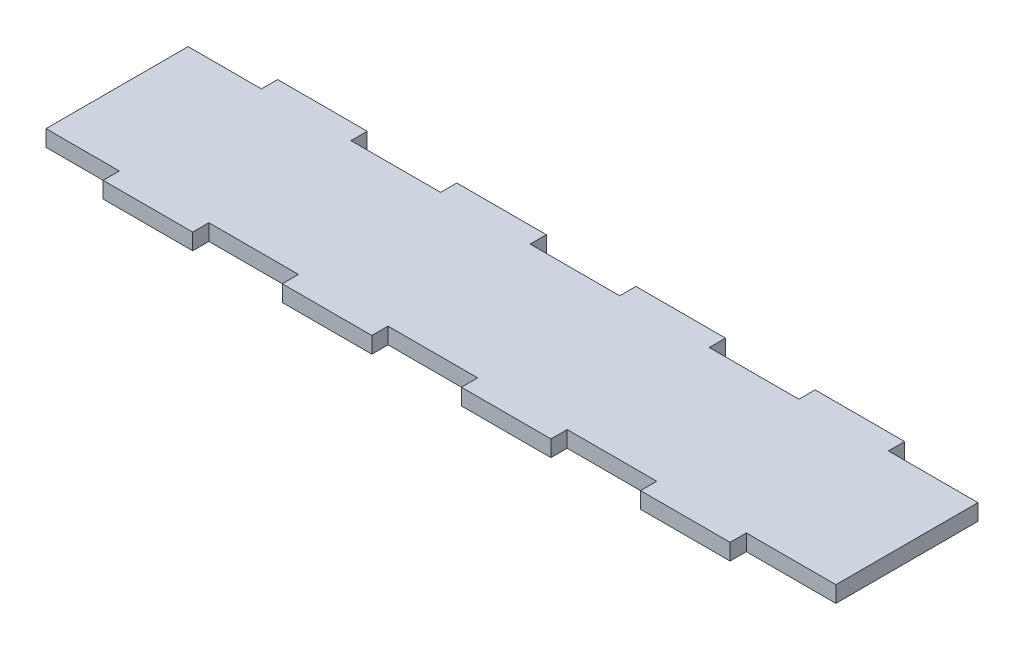
from build123d import *

# Parameters (mm, degrees)
SKETCH1_W           = 228.6
SKETCH1_H           = 49.499999806
BOSS_EXTRUDE1_DEPTH = 4.599999944
SKETCH3_W           = 25.4
SKETCH3_H           = 4.599999944
CUT_EXTRUDE1_DEPTH  = 234.943091328
SKETCH4_W           = 4.599999944
SKETCH4_H           = 40.299999918
CUT_EXTRUDE2_DEPTH  = 234.943091328


with BuildPart() as part:
    # Sketch1 → Boss-Extrude1 (new body)
    with BuildSketch(Plane(origin=(0, 0, 0), x_dir=(1, 0, 0), z_dir=(0, 1, 0))):
        with Locations((114.3, 24.749999903)):
            Rectangle(SKETCH1_W, SKETCH1_H)
    extrude(amount=BOSS_EXTRUDE1_DEPTH)

    # Sketch3 → Cut-Extrude1 (cut, through all)
    with BuildSketch(Plane(origin=(0, 4.599999944, 0), x_dir=(1, 0, 0), z_dir=(0, 1, 0))):
        with Locations((12.7, 2.299999972)):
            Rectangle(SKETCH3_W, SKETCH3_H)
        with Locations((63.5, 2.299999972)):
            Rectangle(SKETCH3_W, SKETCH3_H)
        with Locations((114.3, 2.299999972)):
            Rectangle(SKETCH3_W, SKETCH3_H)
        with Locations((165.1, 2.299999972)):
            Rectangle(SKETCH3_W, SKETCH3_H)
        with Locations((215.9, 2.299999972)):
            Rectangle(SKETCH3_W, SKETCH3_H)
    cut_extrude1 = extrude(amount=-CUT_EXTRUDE1_DEPTH, mode=Mode.SUBTRACT)

    # Mirror1: Cut-Extrude1 across plane
    add(cut_extrude1.mirror(Plane(origin=(0, 0, -24.749999903), x_dir=(1, 0, 0), z_dir=(0, 0, -1))), mode=Mode.SUBTRACT)

    # Sketch4 → Cut-Extrude2 (cut, through all)
    with BuildSketch(Plane(origin=(0, 4.599999944, 0), x_dir=(1, 0, 0), z_dir=(0, 1, 0))):
        with Locations((2.299999972, 24.749999903)):
            Rectangle(SKETCH4_W, SKETCH4_H)
    extrude(amount=-CUT_EXTRUDE2_DEPTH, mode=Mode.SUBTRACT)


solid = part.part
